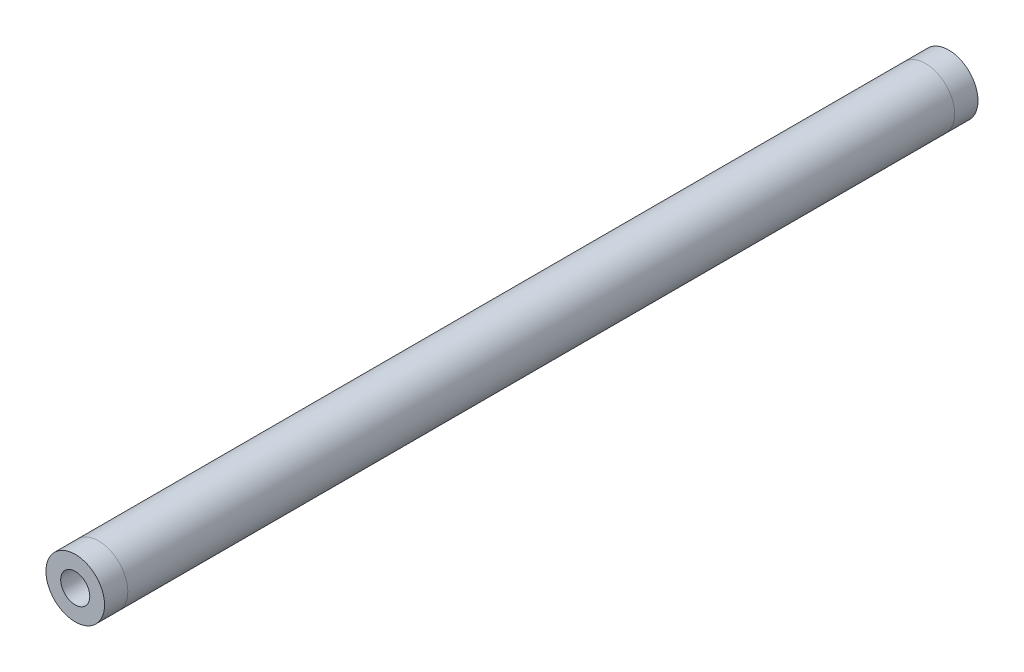
from build123d import *

# Parameters (mm, degrees)
SKETCH1_R                 = 8.001
SKETCH1_R_2               = 6.477
SKETCH1_R_3               = 3.96875
THREADED_INSERT_1_1_DEPTH = 6.35
THREADED_START            = -6.35
SKETCH1_3_R               = 6.477
SKETCH1_3_R_2             = 3.96875
THREADED_INSERT_1_2_DEPTH = 9.525
TUBE_START                = -6.35
SKETCH1_4_R               = 8.001
SKETCH1_4_R_2             = 6.477
TUBE_EXTRUDE_DEPTH        = 225.813185
THREADED_START_2          = -232.163185
SKETCH1_6_R               = 6.477
SKETCH1_6_R_2             = 3.96875
THREADED_INSERT_2_1_DEPTH = 9.525
SKETCH1_9_R               = 8.001
SKETCH1_9_R_2             = 6.477
SKETCH1_9_R_3             = 3.96875
THREADED_INSERT_2_2_DEPTH = 6.35


with BuildPart() as part:
    # Sketch1 → Threaded insert 1-1 (new body)
    # profile 1 of 2: a face of its own
    with BuildSketch(Plane.XY):
        Circle(SKETCH1_R)
        Circle(SKETCH1_R_2, mode=Mode.SUBTRACT)
    # profile 2 of 2: a face of its own
    with BuildSketch(Plane.XY):
        Circle(SKETCH1_R_2)
        Circle(SKETCH1_R_3, mode=Mode.SUBTRACT)
    extrude(amount=-THREADED_INSERT_1_1_DEPTH)

    # Sketch1<3> → Threaded insert 1-2 (add)
    with BuildSketch(Plane.XY.offset(THREADED_START)):
        Circle(SKETCH1_3_R)
        Circle(SKETCH1_3_R_2, mode=Mode.SUBTRACT)
    extrude(amount=-THREADED_INSERT_1_2_DEPTH)


with BuildPart() as body_2:
    # Sketch1<4> → Tube extrude (new body)
    with BuildSketch(Plane.XY.offset(TUBE_START)):
        Circle(SKETCH1_4_R)
        Circle(SKETCH1_4_R_2, mode=Mode.SUBTRACT)
    extrude(amount=-TUBE_EXTRUDE_DEPTH)


with BuildPart() as body_3:
    # Sketch1<6> → Threaded insert 2-1 (new body)
    with BuildSketch(Plane.XY.offset(THREADED_START_2)):
        Circle(SKETCH1_6_R)
        Circle(SKETCH1_6_R_2, mode=Mode.SUBTRACT)
    extrude(amount=THREADED_INSERT_2_1_DEPTH)


with BuildPart() as body_4:
    # Sketch1<9> → Threaded insert 2-2 (new body)
    # profile 1 of 2: a face of its own
    with BuildSketch(Plane.XY.offset(THREADED_START_2)):
        Circle(SKETCH1_9_R)
        Circle(SKETCH1_9_R_2, mode=Mode.SUBTRACT)
    # profile 2 of 2: a face of its own
    with BuildSketch(Plane.XY.offset(THREADED_START_2)):
        Circle(SKETCH1_9_R_2)
        Circle(SKETCH1_9_R_3, mode=Mode.SUBTRACT)
    extrude(amount=-THREADED_INSERT_2_2_DEPTH)

    # Combine1: union body 3
    add(body_3.part)


solid = Compound([part.part, body_2.part, body_4.part])
